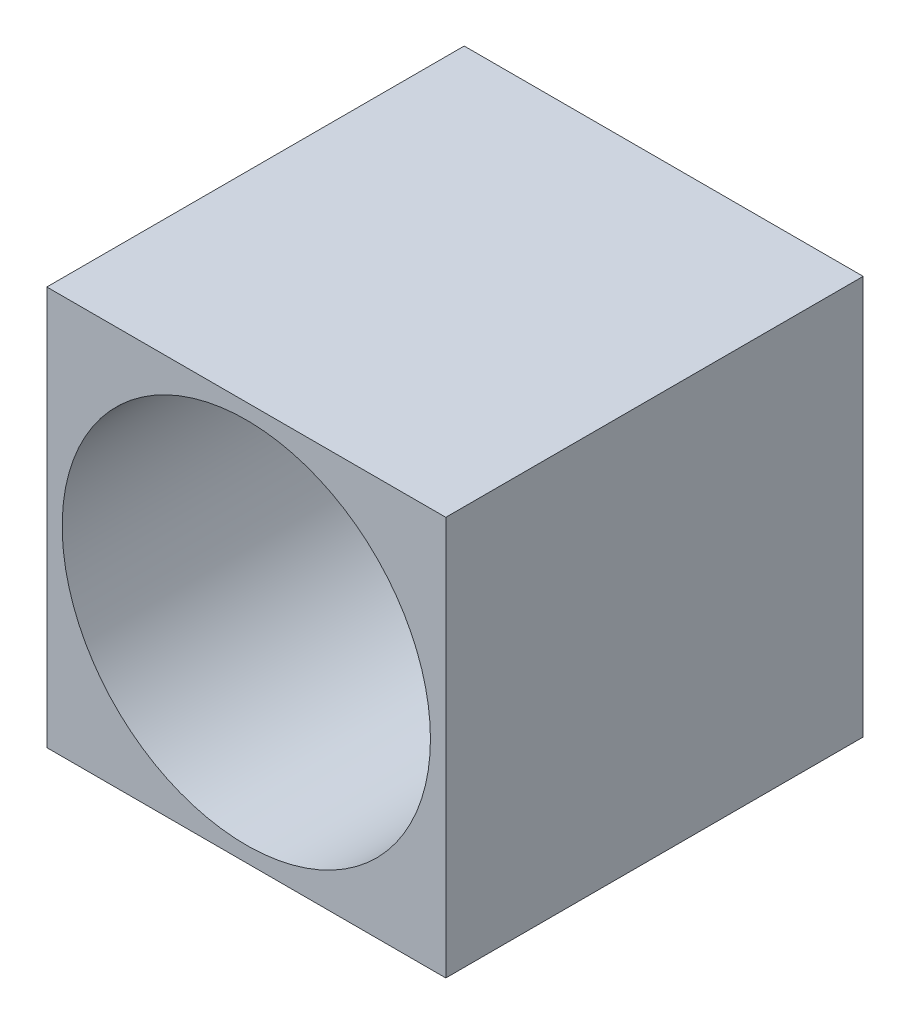
from build123d import *

# Parameters (mm, degrees)
SKETCH1_W           = 3.25
SKETCH1_H           = 3.25
SKETCH1_R           = 1.5
BOSS_EXTRUDE1_DEPTH = 3.4


with BuildPart() as part:
    # Sketch1 → Boss-Extrude1 (new body)
    with BuildSketch(Plane(origin=(0, 0, 0), x_dir=(-1, 0, 0), z_dir=(0, 0, -1))):
        Rectangle(SKETCH1_W, SKETCH1_H)
        with Locations(Location((0, 0, 0), (0, 0, 180))):
            Circle(SKETCH1_R, mode=Mode.SUBTRACT)
    extrude(amount=-BOSS_EXTRUDE1_DEPTH)


solid = part.part
